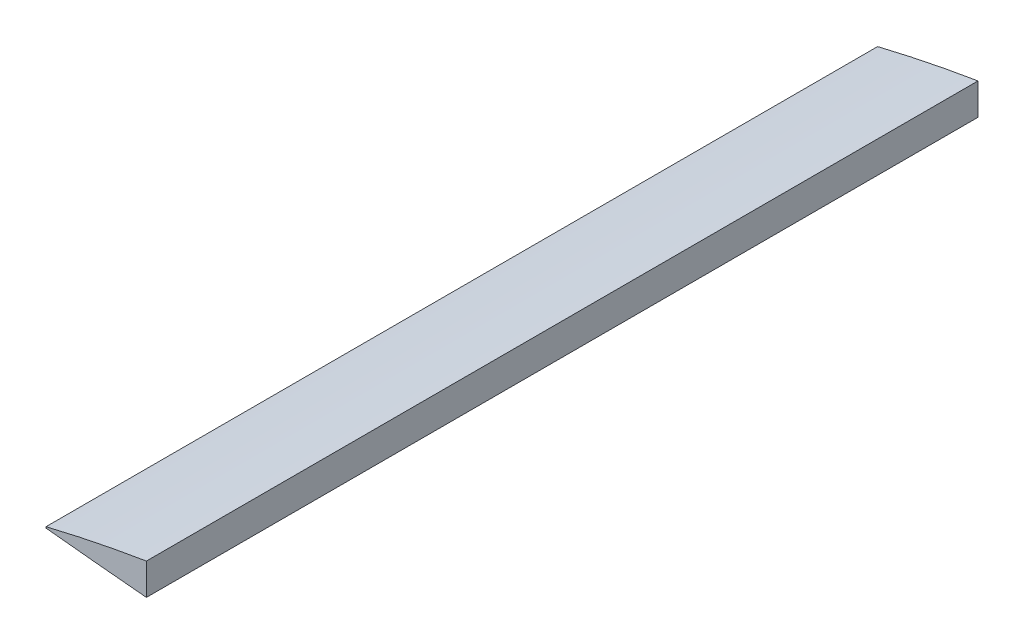
from build123d import *

# Parameters (mm, degrees)
BOSS_EXTRUDE1_DEPTH = 612
SKETCH2_W           = 21
SKETCH2_H           = 11.5
CUT_EXTRUDE1_DEPTH  = 13


with BuildPart() as part:
    # Sketch1 → Boss-Extrude1 (new body)
    with BuildSketch(Plane.XY):
        with BuildLine():
            Line((-210.29024, 15.505831452), (-210.29024, -7.684831645))
            add(Edge.make_bspline(
                [(-210.29024, -7.684831645), (-212.158655952, -7.515448816), (-217.124973789, -7.06522307), (-225.019553341, -6.331687852), (-233.787735511, -5.505727752), (-241.996045088, -4.71925279), (-249.592304467, -3.9801145), (-256.527861272, -3.294770041), (-262.758082866, -2.670079607), (-268.242600772, -2.111780802), (-272.945834406, -1.628193193), (-276.836698489, -1.219072841), (-279.890503934, -0.906023666), (-282.084971372, -0.653321358), (-283.409976301, -0.546659805), (-284.007600869, -0.445986487), (-284.166073983, -0.446550556), (-284.176, -0.446585887)],
                knots=[0, 0, 0, 0, 0.075810952, 0.201508279, 0.320388141, 0.43169539, 0.534719075, 0.628797147, 0.713321079, 0.787740393, 0.851567051, 0.904379655, 0.945827345, 0.975633259, 0.993597432, 0.999598973, 1, 1, 1, 1], degree=3))
            Line((-284.176, -0.446585887), (-284.176, 0.453857008))
            add(Edge.make_bspline(
                [(-210.29024, 15.505831452), (-212.448163353, 15.147934069), (-217.698820474, 14.277098484), (-225.855056301, 12.82414284), (-234.573859634, 11.204768289), (-242.716368314, 9.619953964), (-250.234652113, 8.096769218), (-257.084001233, 6.657241094), (-263.224123516, 5.323919979), (-268.619097385, 4.11810916), (-273.237578484, 3.059760068), (-277.052897895, 2.166891095), (-280.04316213, 1.455156882), (-282.19127614, 0.937226777), (-283.475130043, 0.62509225), (-284.041595768, 0.4866944), (-284.176, 0.453857008)],
                knots=[0, 0, 0, 0, 0.087007005, 0.211705365, 0.329527113, 0.439740645, 0.541660709, 0.634652346, 0.718134669, 0.791584505, 0.854539888, 0.906603358, 0.947445002, 0.976805146, 0.994496602, 1, 1, 1, 1], degree=3))
        make_face()
    extrude(amount=-BOSS_EXTRUDE1_DEPTH)

    # Sketch2 → Cut-Extrude1 (cut)
    with BuildSketch(Plane.XY.offset(-96.9)):
        with Locations((-223.132, -2.442)):
            Rectangle(SKETCH2_W, SKETCH2_H)
    extrude(amount=CUT_EXTRUDE1_DEPTH, mode=Mode.SUBTRACT)


solid = part.part
